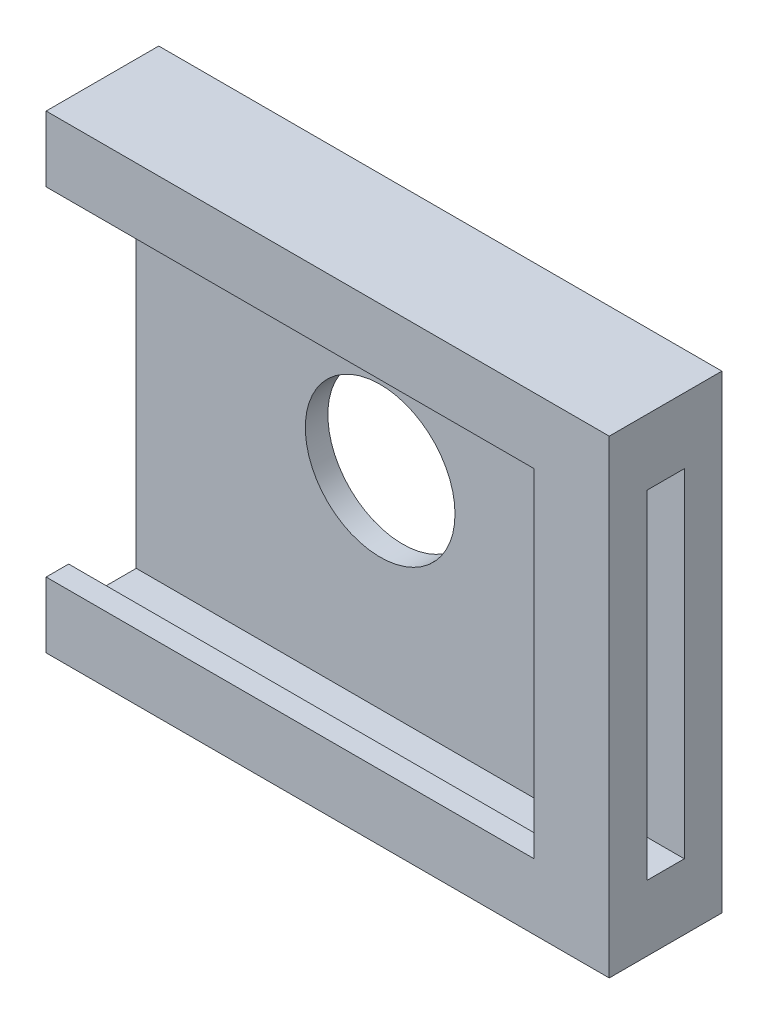
from build123d import *

# Parameters (mm, degrees)
SKETCH1_W           = 15
SKETCH1_H           = 12.5
BOSS_EXTRUDE1_DEPTH = 3
CUT_EXTRUDE1_DEPTH  = 13
SKETCH4_W           = 1
SKETCH4_H           = 9
CUT_EXTRUDE2_DEPTH  = 19.282505299
SKETCH5_R           = 1.9939
CUT_EXTRUDE3_DEPTH  = 1082.289832046


with BuildPart() as part:
    # Sketch1 → Boss-Extrude1 (new body)
    with BuildSketch(Plane.XY):
        with Locations((-7.5, 6.25)):
            Rectangle(SKETCH1_W, SKETCH1_H)
    extrude(amount=BOSS_EXTRUDE1_DEPTH)

    # Sketch3 → Cut-Extrude1 (cut)
    with BuildSketch(Plane.ZY.offset(15)):
        Polygon((0.6, 11.75), (2.4, 11.75), (2.4, 10.75), (3, 10.75), (3, 1.75), (2.4, 1.75), (2.4, 0.75), (0.6, 0.75), align=None)
    extrude(amount=-CUT_EXTRUDE1_DEPTH, mode=Mode.SUBTRACT)

    # Sketch4 → Cut-Extrude2 (cut, through all)
    with BuildSketch(Plane.ZY.offset(2)):
        with Locations((1.5, 6.25)):
            Rectangle(SKETCH4_W, SKETCH4_H)
    extrude(amount=-CUT_EXTRUDE2_DEPTH, mode=Mode.SUBTRACT)

    # Sketch5 → Cut-Extrude3 (cut, through all)
    with BuildSketch(Plane(origin=(-632.3963488, -864.572858382, 0.6), x_dir=(1, 0, 0), z_dir=(0, 0, 1))):
        with Locations((623.8939488, 870.822858382)):
            Circle(SKETCH5_R)
    extrude(amount=-CUT_EXTRUDE3_DEPTH, mode=Mode.SUBTRACT)


solid = part.part
